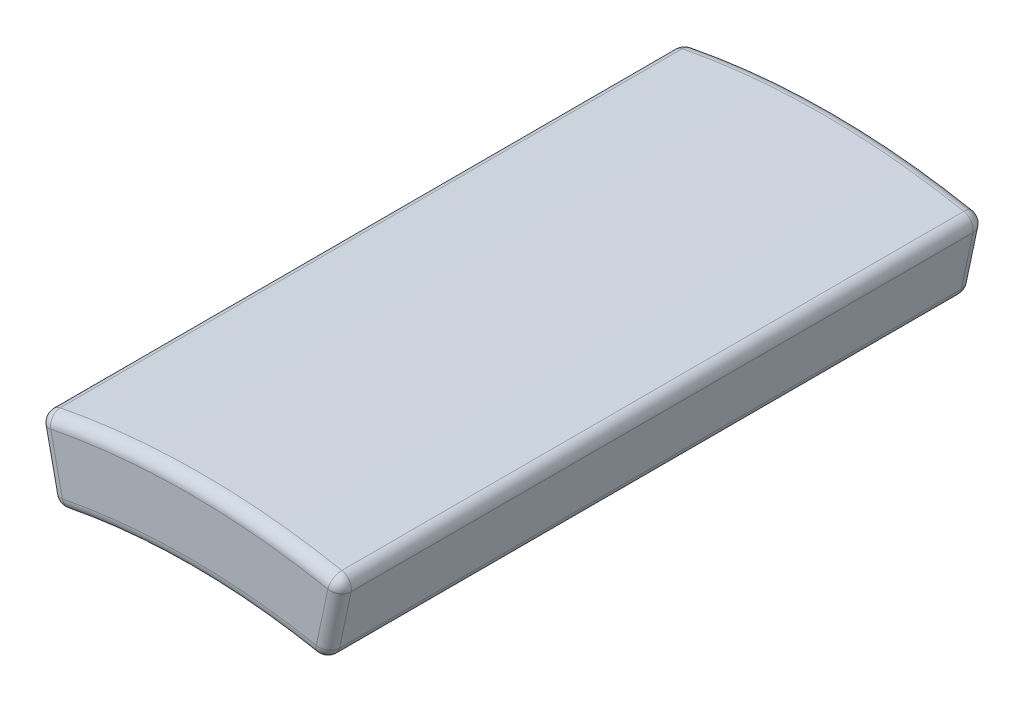
from build123d import *

# Parameters (mm, degrees)
BOSS_EXTRUDE2_DEPTH = 11
FILLET1_R           = 0.4


with BuildPart() as part:
    # Sketch4 → Boss-Extrude2 (new, symmetric)
    with BuildSketch(Plane.XY):
        with BuildLine():
            Line((-5.19779227, 0.803690018), (-4.636430705, -1.837308504))
            ThreePointArc((-4.636430705, -1.837308504), (0, -1.35), (4.636430705, -1.837308504))
            Line((4.636430705, -1.837308504), (5.19779227, 0.803690018))
            ThreePointArc((5.19779227, 0.803690018), (0, 1.35), (-5.19779227, 0.803690018))
        make_face()
    extrude(amount=BOSS_EXTRUDE2_DEPTH, both=True)

    # Fillet1
    fillet1_edges = [part.edges().sort_by_distance(p)[0] for p in [
        (0, 1.35, 11),
        (-4.917111488, -0.516809243, 11),
        (0, -1.35, 11),
        (-4.917111488, -0.516809243, -11),
        (0, 1.35, -11),
        (4.917111488, -0.516809243, -11),
        (0, -1.35, -11),
        (-4.636430705, -1.837308504, 0),
        (-5.19779227, 0.803690018, 0),
        (5.19779227, 0.803690018, 0),
        (4.636430705, -1.837308504, 0),
        (4.917111488, -0.516809243, 11),
    ]]
    fillet(fillet1_edges, radius=FILLET1_R)


solid = part.part
